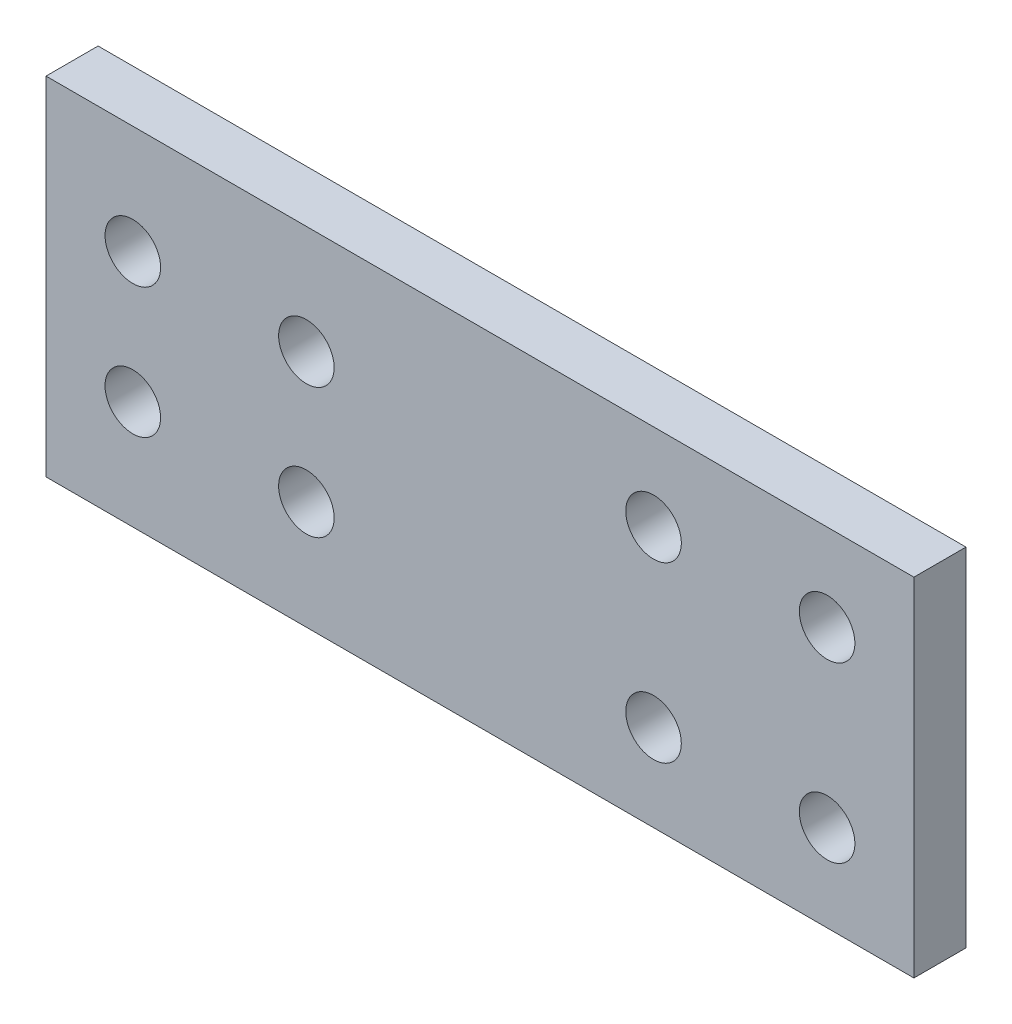
from build123d import *

# Parameters (mm, degrees)
SKETCH_1_W      = 50
SKETCH_1_H      = 20
SKETCH_1_R      = 1.6
EXTRUDE_1_DEPTH = 3


with BuildPart() as part:
    # 草图1 → 凸台-拉伸1 (new body)
    with BuildSketch(Plane.XY):
        with Locations((25, -10)):
            Rectangle(SKETCH_1_W, SKETCH_1_H)
        with Locations((45, -5)):
            Circle(SKETCH_1_R, mode=Mode.SUBTRACT)
        with Locations(Location((45, -15, 0), (0, 0, 180))):
            Circle(SKETCH_1_R, mode=Mode.SUBTRACT)
        with Locations((35, -15)):
            Circle(SKETCH_1_R, mode=Mode.SUBTRACT)
        with Locations(Location((35, -5, 0), (0, 0, 180))):
            Circle(SKETCH_1_R, mode=Mode.SUBTRACT)
        with Locations((5, -6.25)):
            Circle(SKETCH_1_R, mode=Mode.SUBTRACT)
        with Locations(Location((5, -13.75, 0), (0, 0, 180))):
            Circle(SKETCH_1_R, mode=Mode.SUBTRACT)
        with Locations((15, -13.75)):
            Circle(SKETCH_1_R, mode=Mode.SUBTRACT)
        with Locations(Location((15, -6.25, 0), (0, 0, 180))):
            Circle(SKETCH_1_R, mode=Mode.SUBTRACT)
    extrude(amount=EXTRUDE_1_DEPTH)


solid = part.part
